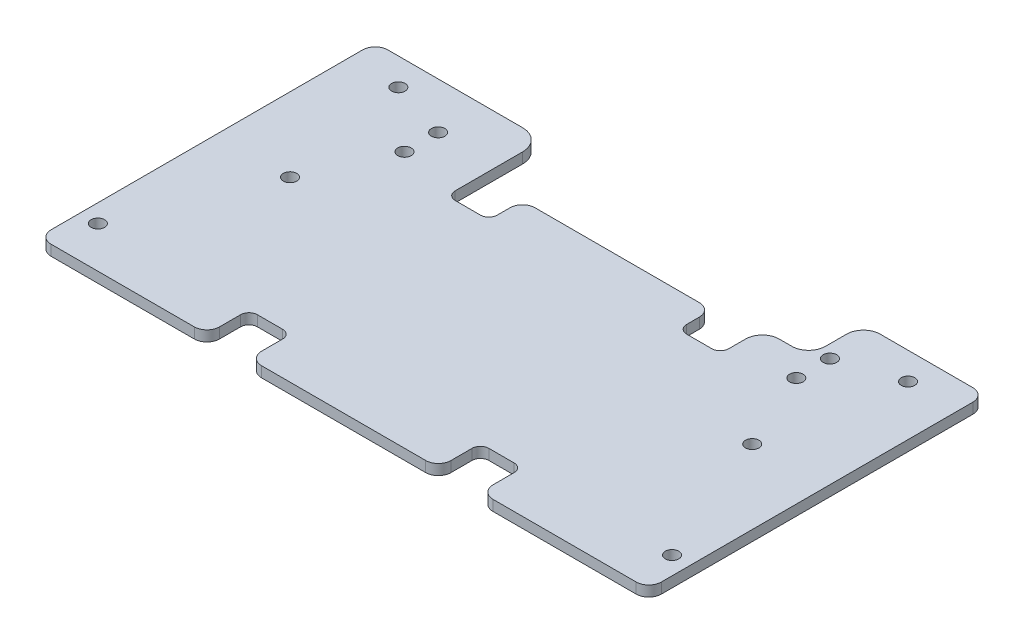
from build123d import *

# Parameters (mm, degrees)
BOSS_EXTRUDE1_DEPTH     = 3.175
FILLET1_R               = 3.81
SKETCH2_R               = 2.032
CUT_EXTRUDE1_DEPTH      = 211.342252353
FILLET2_R               = 6.35
FILLET3_R               = 2.54
FILLET4_R               = 3.81
FILLET5_R               = 3.81
CUT_EXTRUDE2_DEPTH      = 211.342252353
CUT_EXTRUDE2_DEPTH_BACK = 211.342252353
FILLET6_R               = 5.08


with BuildPart() as part:
    # Sketch1 → Boss-Extrude1 (new body)
    with BuildSketch(Plane(origin=(0, 0, 0), x_dir=(1, 0, 0), z_dir=(0, 1, 0))):
        Polygon((50.8, 0), (0, 0), (0, -101.6), (50.8, -101.6), (50.8, -88.9), (63.5, -88.9), (63.5, -101.6), (120.65, -101.6), (120.65, -88.9), (133.35, -88.9), (133.35, -101.6), (184.15, -101.6), (184.15, 0), (133.35, 0), (133.35, -29.21), (120.65, -29.21), (120.65, -19.05), (63.5, -19.05), (63.5, -29.21), (50.8, -29.21), align=None)
    extrude(amount=BOSS_EXTRUDE1_DEPTH)

    # Fillet1
    fillet1_edges = [part.edges().sort_by_distance(p)[0] for p in [
        (184.15, 1.5875, 101.6),
        (0, 1.5875, 101.6),
        (184.15, 1.5875, 0),
        (0, 1.5875, 0),
    ]]
    fillet(fillet1_edges, radius=FILLET1_R)

    # Sketch2 → Cut-Extrude1 (cut, through all)
    with BuildSketch(Plane(origin=(0, 3.175, 0), x_dir=(1, 0, 0), z_dir=(0, 1, 0))):
        with Locations((5.437401114, -89.146320086)):
            Circle(SKETCH2_R)
        with Locations((178.712598886, -89.146320086)):
            Circle(SKETCH2_R)
        with Locations((22.338907609, -48.03498858)):
            Circle(SKETCH2_R)
        with Locations((15.16630044, -8.195189781)):
            Circle(SKETCH2_R)
        with Locations((32.94630044, -24.13)):
            Circle(SKETCH2_R)
        with Locations((32.94630044, -13.97)):
            Circle(SKETCH2_R)
        with Locations((161.811092391, -48.03498858)):
            Circle(SKETCH2_R)
        with Locations((151.20369956, -24.13)):
            Circle(SKETCH2_R)
        with Locations((151.20369956, -13.97)):
            Circle(SKETCH2_R)
        with Locations((168.98369956, -8.195189781)):
            Circle(SKETCH2_R)
    extrude(amount=-CUT_EXTRUDE1_DEPTH, mode=Mode.SUBTRACT)

    # Fillet2
    fillet2_edges = [part.edges().sort_by_distance(p)[0] for p in [
        (50.8, 1.5875, 0),
        (133.35, 1.5875, 0),
    ]]
    fillet(fillet2_edges, radius=FILLET2_R)

    # Fillet3
    fillet3_edges = [part.edges().sort_by_distance(p)[0] for p in [
        (133.35, 1.5875, 29.21),
        (120.65, 1.5875, 29.21),
        (50.8, 1.5875, 29.21),
        (63.5, 1.5875, 29.21),
        (133.35, 1.5875, 88.9),
        (120.65, 1.5875, 88.9),
        (63.5, 1.5875, 88.9),
        (50.8, 1.5875, 88.9),
    ]]
    fillet(fillet3_edges, radius=FILLET3_R)

    # Fillet4
    fillet4_edges = [part.edges().sort_by_distance(p)[0] for p in [
        (120.65, 1.5875, 19.05),
        (63.5, 1.5875, 19.05),
    ]]
    fillet(fillet4_edges, radius=FILLET4_R)

    # Fillet5
    fillet5_edges = [part.edges().sort_by_distance(p)[0] for p in [
        (133.35, 1.5875, 101.6),
        (120.65, 1.5875, 101.6),
        (63.5, 1.5875, 101.6),
        (50.8, 1.5875, 101.6),
    ]]
    fillet(fillet5_edges, radius=FILLET5_R)

    # Sketch9 → Cut-Extrude2 (cut, two sides: drawn at the far end of the back side and taken through both)
    with BuildSketch(Plane.XZ.offset(-CUT_EXTRUDE2_DEPTH_BACK)):
        with BuildLine():
            Line((147.32, 16.51), (133.35, 16.51))
            Line((133.35, 16.51), (133.35, 6.35))
            ThreePointArc((133.35, 6.35), (135.209871939, 1.859871939), (139.7, 0))
            Line((139.7, 0), (147.32, 0))
            Line((147.32, 0), (147.32, 16.51))
        make_face()
    extrude(amount=CUT_EXTRUDE2_DEPTH + CUT_EXTRUDE2_DEPTH_BACK, mode=Mode.SUBTRACT)

    # Fillet6
    fillet6_edges = [part.edges().sort_by_distance(p)[0] for p in [
        (147.32, 1.5875, 0),
        (147.32, 1.5875, 16.51),
        (133.35, 1.5875, 16.51),
    ]]
    fillet(fillet6_edges, radius=FILLET6_R)


solid = part.part
